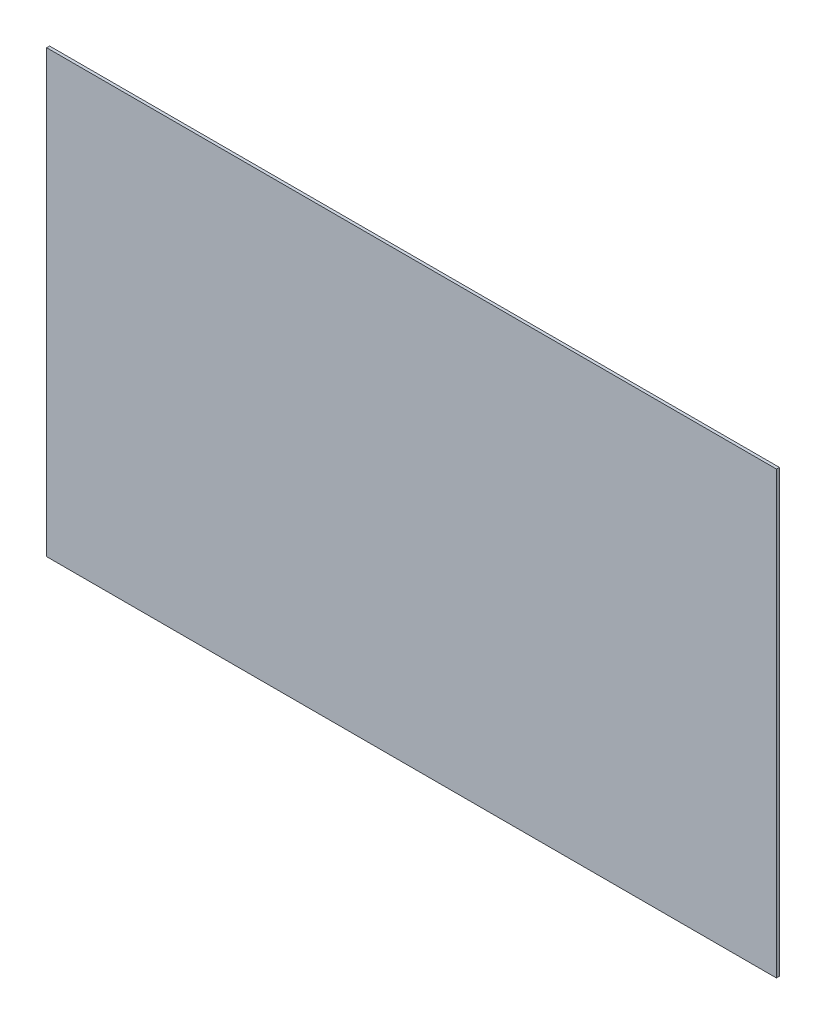
from build123d import *

# Parameters (mm, degrees)
SKETCH1_W           = 2500
SKETCH1_H           = 1510
BOSS_EXTRUDE1_DEPTH = 10


with BuildPart() as part:
    # Sketch1 → Boss-Extrude1 (new body)
    with BuildSketch(Plane.XY):
        with Locations((1250, 755)):
            Rectangle(SKETCH1_W, SKETCH1_H)
    extrude(amount=BOSS_EXTRUDE1_DEPTH)


solid = part.part
